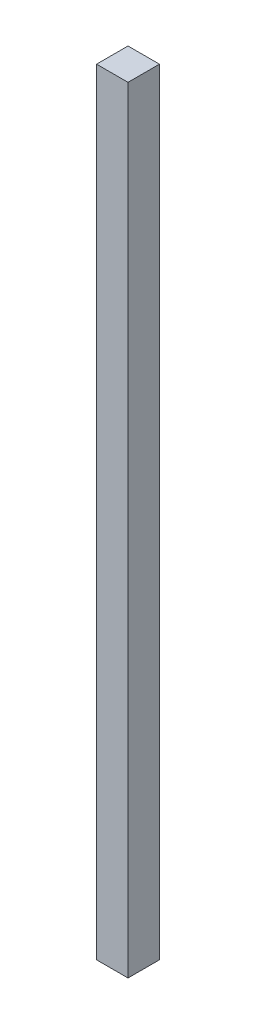
from build123d import *

# Parameters (mm, degrees)
SKETCH1_W           = 15
SKETCH1_H           = 15
BOSS_EXTRUDE1_DEPTH = 370


with BuildPart() as part:
    # Sketch1 → Boss-Extrude1 (new body)
    with BuildSketch(Plane(origin=(0, 0, 0), x_dir=(1, 0, 0), z_dir=(0, 1, 0))):
        with Locations((7.5, 7.5)):
            Rectangle(SKETCH1_W, SKETCH1_H)
    extrude(amount=BOSS_EXTRUDE1_DEPTH)


solid = part.part
